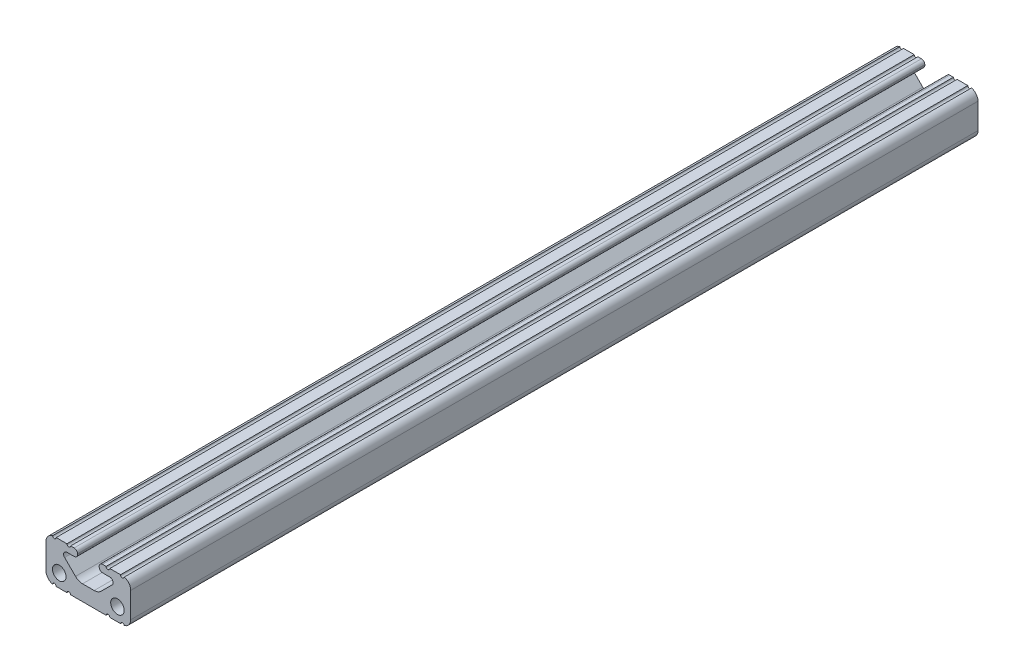
from build123d import *

# Parameters (mm, degrees)
SKETCH3_R               = 2.032
BOSS_EXTRUDE1_DEPTH     = 152.4
CUT_EXTRUDE1_DEPTH      = 154.060029074
CUT_EXTRUDE1_DEPTH_BACK = 154.060029074
SKETCH4_R               = 0.55245
CUT_EXTRUDE2_DEPTH      = 50.8


with BuildPart() as part:
    # Sketch3 → Boss-Extrude1 (new, symmetric)
    with BuildSketch(Plane.XY):
        with BuildLine():
            Line((3.2512, 5.35559), (3.2512, 5.13461))
            ThreePointArc((3.2512, 5.13461), (3.542455946, 4.431455946), (4.24561, 4.1402))
            Line((4.24561, 4.1402), (6.42239, 4.1402))
            ThreePointArc((6.42239, 4.1402), (7.341105046, 3.526334232), (7.125544054, 2.442635946))
            Line((7.125544054, 2.442635946), (3.854875946, -0.828032163))
            ThreePointArc((3.854875946, -0.828032163), (2.887046479, -1.474715138), (1.745413783, -1.7018))
            Line((1.745413783, -1.7018), (0, -1.7018))
            Line((0, -1.7018), (0, -6.35))
            Line((0, -6.35), (10.16, -6.35))
            ThreePointArc((10.16, -6.35), (11.956051224, -5.606051224), (12.7, -3.81))
            Line((12.7, -3.81), (12.7, 3.81))
            ThreePointArc((12.7, 3.81), (11.956051224, 5.606051224), (10.16, 6.35))
            Line((10.16, 6.35), (4.24561, 6.35))
            ThreePointArc((4.24561, 6.35), (3.542455946, 6.058744054), (3.2512, 5.35559))
        make_face()
        with Locations(Location((8.7249, -2.3876, 0), (0, 0, 180))):
            Circle(SKETCH3_R, mode=Mode.SUBTRACT)
    extrude(amount=BOSS_EXTRUDE1_DEPTH, both=True)

    # Sketch4 → Cut-Extrude1 (cut, two sides: drawn at the far end of the back side and taken through both)
    with BuildSketch(Plane.XY.offset(-CUT_EXTRUDE1_DEPTH_BACK)):
        with Locations((5.86994, 6.35)):
            Circle(SKETCH4_R)
        with Locations((10.20445, 6.35)):
            Circle(SKETCH4_R)
        with Locations((5.86994, -6.35)):
            Circle(SKETCH4_R)
        with Locations((10.20445, -6.35)):
            Circle(SKETCH4_R)
    extrude(amount=CUT_EXTRUDE1_DEPTH + CUT_EXTRUDE1_DEPTH_BACK, mode=Mode.SUBTRACT)

    # Mirror1: part across plane


with BuildPart() as part_1:
    add(part.part)
    add(part.part.mirror(Plane(origin=(0, 0, 0), x_dir=(0, 0, 1), z_dir=(1, 0, 0))))

    # Sketch5 → Cut-Extrude2 (cut)
    with BuildSketch(Plane.XY.offset(152.4)):
        with BuildLine():
            Line((9.652, 6.35), (6.42239, 6.35))
            ThreePointArc((6.42239, 6.35), (5.86994, 5.79755), (5.31749, 6.35))
            Line((5.31749, 6.35), (4.24561, 6.35))
            ThreePointArc((4.24561, 6.35), (3.542455946, 6.058744054), (3.2512, 5.35559))
            Line((3.2512, 5.35559), (3.2512, 5.13461))
            ThreePointArc((3.2512, 5.13461), (3.542455946, 4.431455946), (4.24561, 4.1402))
            Line((4.24561, 4.1402), (6.42239, 4.1402))
            ThreePointArc((6.42239, 4.1402), (7.341105046, 3.526334232), (7.125544054, 2.442635946))
            Line((7.125544054, 2.442635946), (3.854875946, -0.828032163))
            ThreePointArc((3.854875946, -0.828032163), (2.887046479, -1.474715138), (1.745413783, -1.7018))
            Line((1.745413783, -1.7018), (-1.745413783, -1.7018))
            ThreePointArc((-1.745413783, -1.7018), (-2.887046479, -1.474715138), (-3.854875946, -0.828032163))
            Line((-3.854875946, -0.828032163), (-7.125544054, 2.442635946))
            ThreePointArc((-7.125544054, 2.442635946), (-7.341105046, 3.526334232), (-6.42239, 4.1402))
            Line((-6.42239, 4.1402), (-4.24561, 4.1402))
            ThreePointArc((-4.24561, 4.1402), (-3.542455946, 4.431455946), (-3.2512, 5.13461))
            Line((-3.2512, 5.13461), (-3.2512, 5.35559))
            ThreePointArc((-3.2512, 5.35559), (-3.542455946, 6.058744054), (-4.24561, 6.35))
            Line((-4.24561, 6.35), (-5.31749, 6.35))
            ThreePointArc((-5.31749, 6.35), (-5.86994, 5.79755), (-6.42239, 6.35))
            Line((-6.42239, 6.35), (-9.652, 6.35))
            ThreePointArc((-9.652, 6.35), (-10.169350236, 5.798666155), (-10.752439892, 6.279942302))
            ThreePointArc((-10.752439892, 6.279942302), (-12.154542219, 5.382705102), (-12.7, 3.81))
            Line((-12.7, 3.81), (-12.7, -3.81))
            ThreePointArc((-12.7, -3.81), (-12.154542219, -5.382705102), (-10.752439892, -6.279942302))
            ThreePointArc((-10.752439892, -6.279942302), (-10.169350236, -5.798666155), (-9.652, -6.35))
            Line((-9.652, -6.35), (-6.42239, -6.35))
            ThreePointArc((-6.42239, -6.35), (-5.86994, -5.79755), (-5.31749, -6.35))
            Line((-5.31749, -6.35), (5.31749, -6.35))
            ThreePointArc((5.31749, -6.35), (5.86994, -5.79755), (6.42239, -6.35))
            Line((6.42239, -6.35), (9.652, -6.35))
            ThreePointArc((9.652, -6.35), (10.169350236, -5.798666155), (10.752439892, -6.279942302))
            ThreePointArc((10.752439892, -6.279942302), (12.154542219, -5.382705102), (12.7, -3.81))
            Line((12.7, -3.81), (12.7, 3.81))
            ThreePointArc((12.7, 3.81), (12.154542219, 5.382705102), (10.752439892, 6.279942302))
            ThreePointArc((10.752439892, 6.279942302), (10.169350236, 5.798666155), (9.652, 6.35))
        make_face()
    extrude(amount=-CUT_EXTRUDE2_DEPTH, mode=Mode.SUBTRACT)


solid = part_1.part
